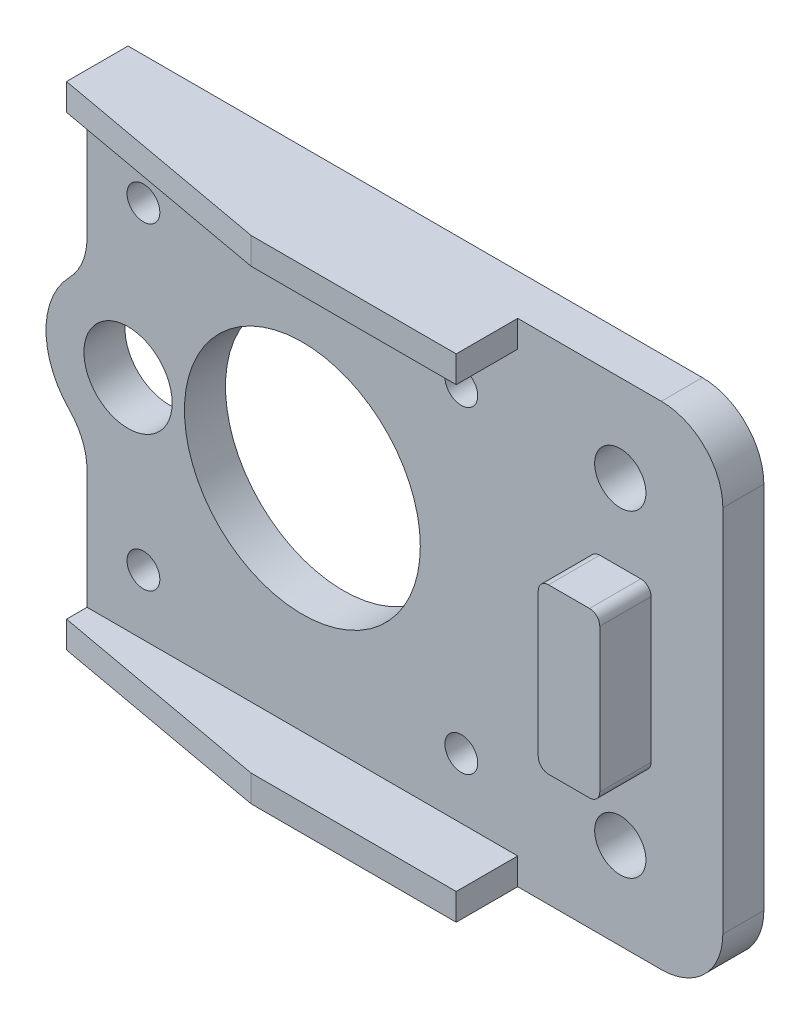
from build123d import *

# Parameters (mm, degrees)
SKETCH_1_R      = 11.5
SKETCH_1_R_2    = 1.6
SKETCH_1_R_3    = 4.3
SKETCH_1_R_4    = 2.5
EXTRUDE_3_DEPTH = 4
SKETCH_4_W      = 42
SKETCH_4_H      = 2.6
EXTRUDE_4_DEPTH = 6
EXTRUDE_5_DEPTH = 5
CHAMFER_3_SIZE  = 4
CHAMFER_3_SIZE2 = 22
CHAMFER_4_SIZE  = 22
CHAMFER_4_SIZE2 = 4


with BuildPart() as part:
    # 草图1 → 凸台-拉伸3 (new body)
    with BuildSketch(Plane.XY):
        with BuildLine():
            Line((-21, 24), (35, 24))
            ThreePointArc((35, 24), (39.242640687, 22.242640687), (41, 18))
            Line((41, 18), (41, -18))
            ThreePointArc((41, -18), (39.242640687, -22.242640687), (35, -24))
            Line((35, -24), (-21, -24))
            Line((-21, -24), (-21, -9.797958971))
            ThreePointArc((-21, -9.797958971), (-21.445079401, -7.530172133), (-22.714285714, -5.598833698))
            ThreePointArc((-22.714285714, -5.598833698), (-25, 0), (-22.714285714, 5.598833698))
            ThreePointArc((-22.714285714, 5.598833698), (-21.445079401, 7.530172133), (-21, 9.797958971))
            Line((-21, 9.797958971), (-21, 24))
        make_face()
        Circle(SKETCH_1_R, mode=Mode.SUBTRACT)
        with Locations((15.5, 15.5)):
            Circle(SKETCH_1_R_2, mode=Mode.SUBTRACT)
        with Locations((15.5, -15.5)):
            Circle(SKETCH_1_R_2, mode=Mode.SUBTRACT)
        with Locations((-15.5, -15.5)):
            Circle(SKETCH_1_R_2, mode=Mode.SUBTRACT)
        with Locations((-15.5, 15.5)):
            Circle(SKETCH_1_R_2, mode=Mode.SUBTRACT)
        with Locations((-17, 0)):
            Circle(SKETCH_1_R_3, mode=Mode.SUBTRACT)
        with Locations((31, 15.5)):
            Circle(SKETCH_1_R_4, mode=Mode.SUBTRACT)
        with Locations((31, -15.5)):
            Circle(SKETCH_1_R_4, mode=Mode.SUBTRACT)
    extrude(amount=EXTRUDE_3_DEPTH)

    # 草图4 → 凸台-拉伸4 (add)
    with BuildSketch(Plane.XY.offset(4)):
        with Locations((0, 22.7)):
            Rectangle(SKETCH_4_W, SKETCH_4_H)
        with Locations((0, -22.7)):
            Rectangle(SKETCH_4_W, SKETCH_4_H)
    extrude(amount=EXTRUDE_4_DEPTH)

    # 草图4<3> → 凸台-拉伸5 (add)
    with BuildSketch(Plane.XY.offset(4)):
        with BuildLine():
            Line((28, 7), (28, -7))
            ThreePointArc((28, -7), (28.292893219, -7.707106781), (29, -8))
            Line((29, -8), (33, -8))
            ThreePointArc((33, -8), (33.707106781, -7.707106781), (34, -7))
            Line((34, -7), (34, 7))
            ThreePointArc((34, 7), (33.707106781, 7.707106781), (33, 8))
            Line((33, 8), (29, 8))
            ThreePointArc((29, 8), (28.292893219, 7.707106781), (28, 7))
        make_face()
    extrude(amount=EXTRUDE_5_DEPTH)

    # 倒角3
    chamfer_3_edges = [part.edges().sort_by_distance(p)[0] for p in [
        (-21, 22.7, 10),
    ]]
    chamfer_3_side = [part.faces().sort_by_distance(p)[0] for p in [
        (-21, 18.1487822, 3.077226594),
    ]]
    chamfer(chamfer_3_edges, length=CHAMFER_3_SIZE, length2=CHAMFER_3_SIZE2, reference=chamfer_3_side[0])

    # 倒角4
    chamfer_4_edges = [part.edges().sort_by_distance(p)[0] for p in [
        (-21, -22.7, 10),
    ]]
    chamfer_4_side = [part.faces().sort_by_distance(p)[0] for p in [
        (0, -22.7, 10),
    ]]
    chamfer(chamfer_4_edges, length=CHAMFER_4_SIZE, length2=CHAMFER_4_SIZE2, reference=chamfer_4_side[0])


solid = part.part
